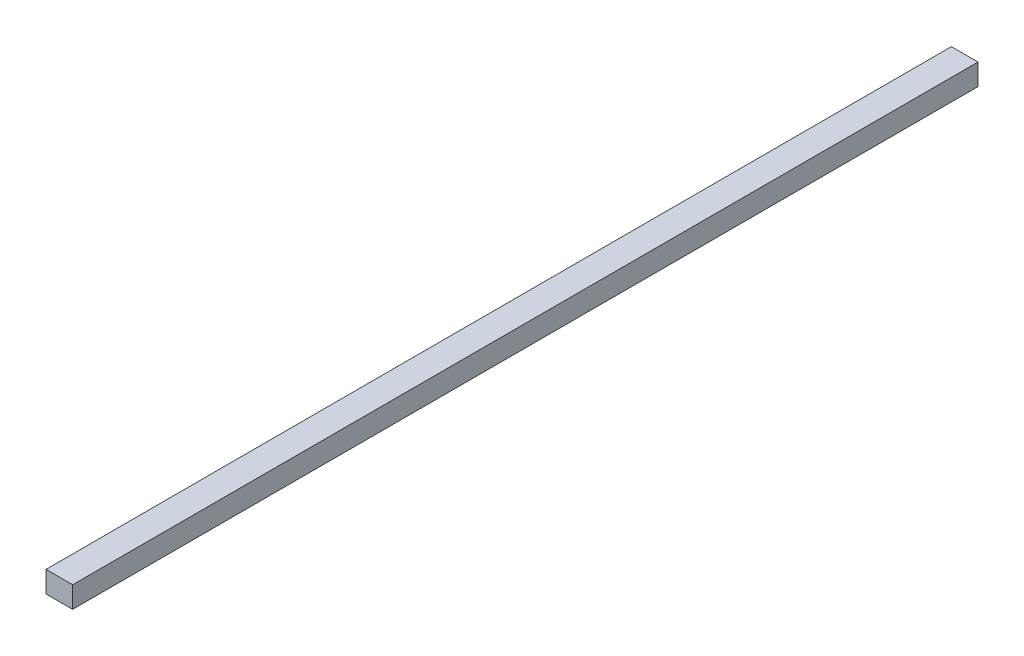
from build123d import *

# Parameters (mm, degrees)
SKETCH_1_W      = 10
SKETCH_1_H      = 8
EXTRUDE_1_DEPTH = 340


with BuildPart() as part:
    # 草圖1 → 填料-伸長1 (new body)
    with BuildSketch(Plane.XY):
        Rectangle(SKETCH_1_W, SKETCH_1_H)
    extrude(amount=EXTRUDE_1_DEPTH)


solid = part.part
